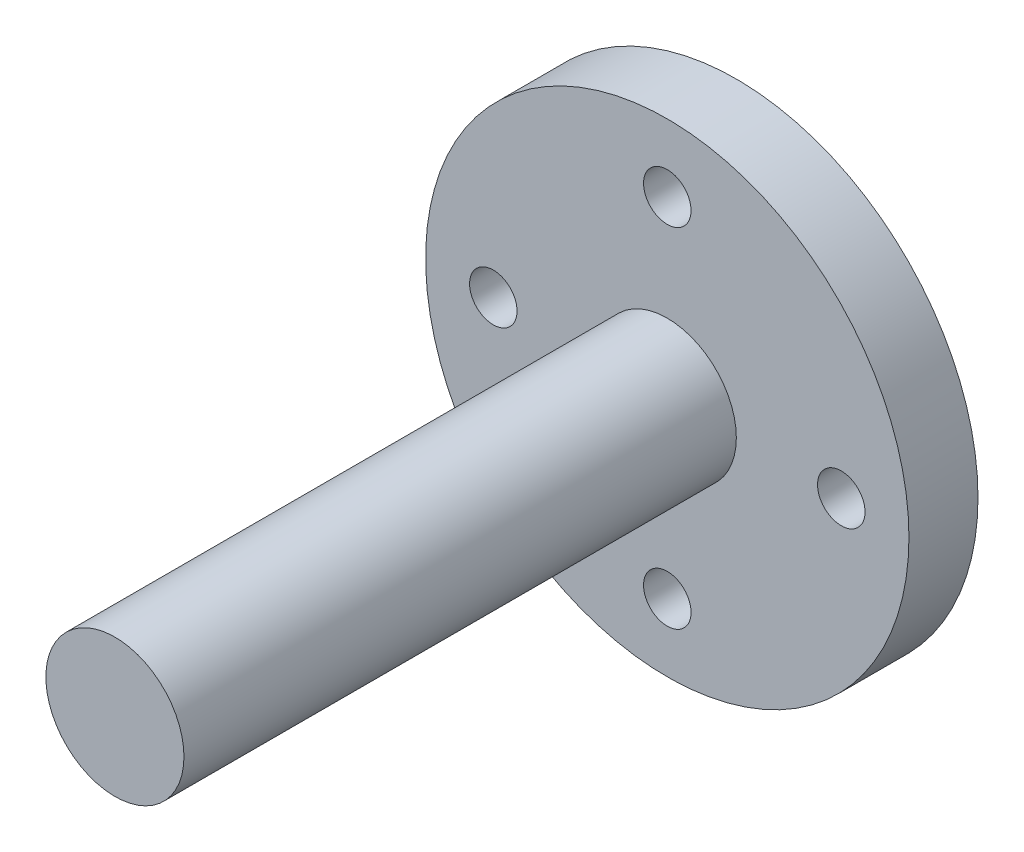
from build123d import *

# Parameters (mm, degrees)
SKETCH1_R                   = 11.1125
BOSS_EXTRUDE1_DEPTH         = 3.175
SKETCH2_R                   = 3.175
BOSS_EXTRUDE2_DEPTH         = 25.4
F_44_0_086_DIAMETER_HOLE1_D = 2.1844


with BuildPart() as part:
    # Sketch1 → Boss-Extrude1 (new body)
    with BuildSketch(Plane.XY):
        Circle(SKETCH1_R)
    extrude(amount=BOSS_EXTRUDE1_DEPTH)

    # Sketch2 → Boss-Extrude2 (add)
    with BuildSketch(Plane.XY.offset(3.175)):
        Circle(SKETCH2_R)
    extrude(amount=BOSS_EXTRUDE2_DEPTH)

    # #44 (0.086) Diameter Hole1 (through all)
    with Locations(Plane.XY.offset(3.175)):
        with Locations((0, 8), (0, -8), (-8, 0), (8, 0)):
            Hole(F_44_0_086_DIAMETER_HOLE1_D / 2)


solid = part.part
